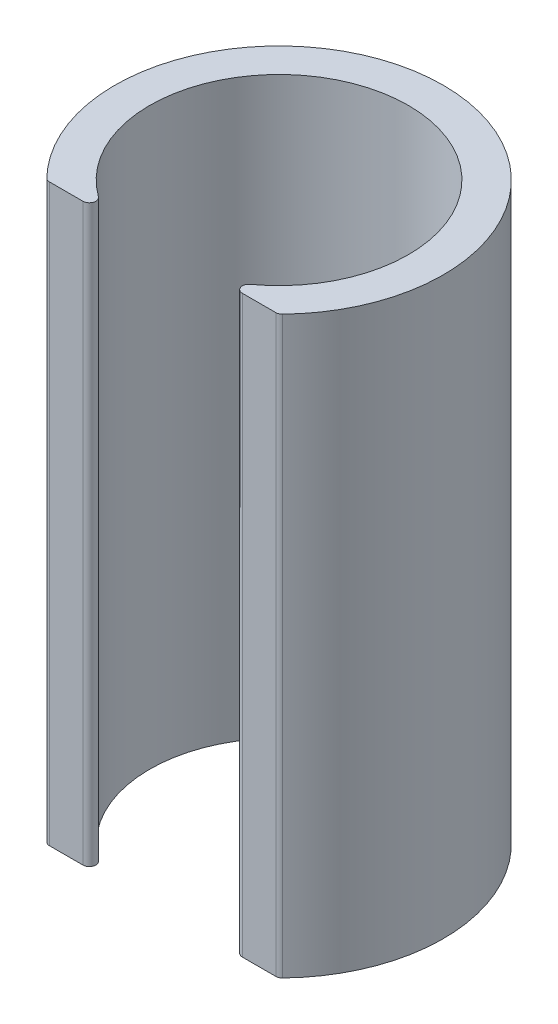
from build123d import *

# Parameters (mm, degrees)
BOSS_EXTRUDE1_DEPTH = 22.225
FILLET1_R           = 0.25


with BuildPart() as part:
    # Sketch1 → Boss-Extrude1 (new body)
    with BuildSketch(Plane(origin=(0, 0, 0), x_dir=(1, 0, 0), z_dir=(0, 1, 0))):
        with BuildLine():
            Line((-2.179449472, -4.5), (-4.480234369, -4.5))
            ThreePointArc((-4.480234369, -4.5), (0, 6.35), (4.480234369, -4.5))
            Line((4.480234369, -4.5), (2.179449472, -4.5))
            ThreePointArc((2.179449472, -4.5), (0, 5), (-2.179449472, -4.5))
        make_face()
    extrude(amount=BOSS_EXTRUDE1_DEPTH)

    # Fillet1
    fillet1_edges = [part.edges().sort_by_distance(p)[0] for p in [
        (4.480234369, 11.1125, 4.5),
        (2.179449472, 11.1125, 4.5),
        (-2.179449472, 11.1125, 4.5),
        (-4.480234369, 11.1125, 4.5),
    ]]
    fillet(fillet1_edges, radius=FILLET1_R)


solid = part.part
